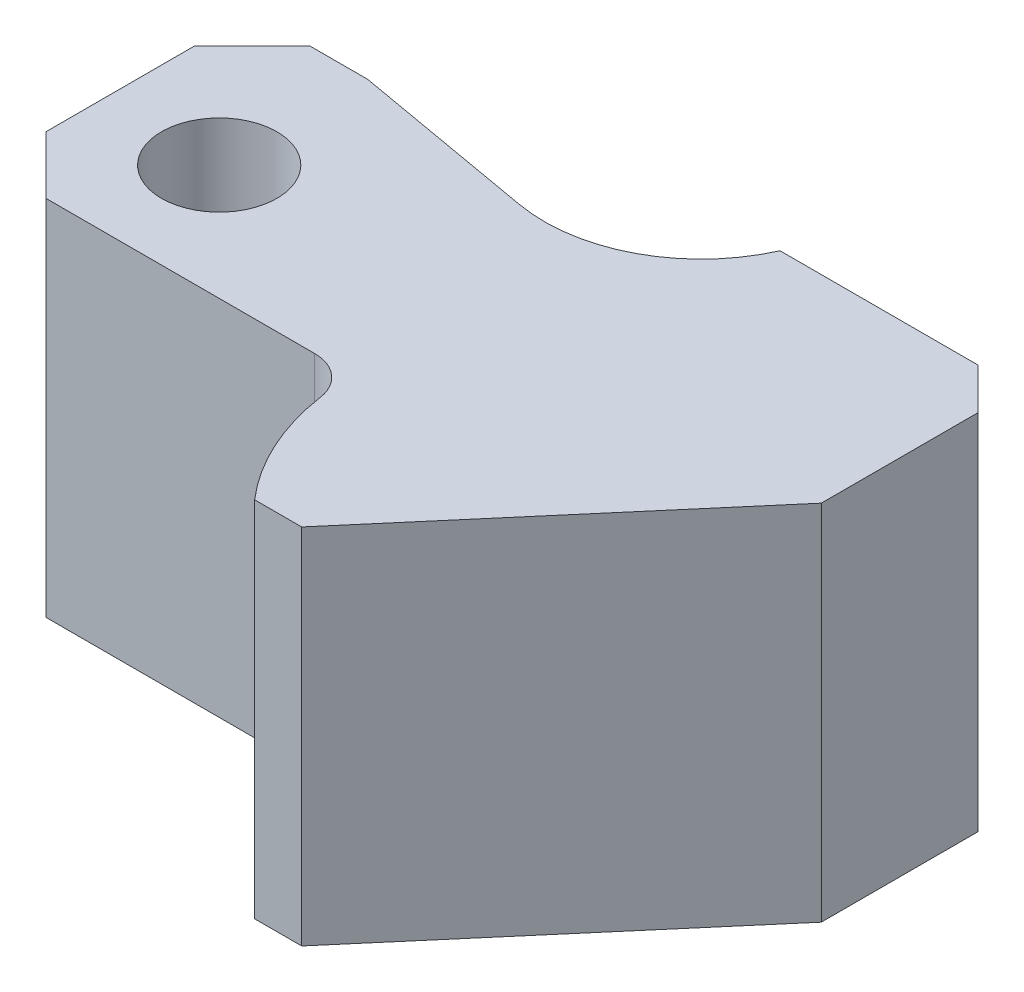
from build123d import *

# Parameters (mm, degrees)
SKETCH2_R           = 7
BOSS_EXTRUDE1_DEPTH = 22


with BuildPart() as part:
    # Sketch2 → Boss-Extrude1 (new, symmetric)
    with BuildSketch(Plane(origin=(0, 0, 0), x_dir=(1, 0, 0), z_dir=(0, 1, 0))):
        with BuildLine():
            Line((-8.044825261, -3.211346175), (-8.044825261, 14.788653825))
            Line((-8.044825261, 14.788653825), (-1.044825261, 21.788653825))
            Line((-1.044825261, 21.788653825), (5.955174739, 21.788653825))
            Line((5.955174739, 21.788653825), (28.316555575, 17.845739058))
            ThreePointArc((28.316555575, 17.845739058), (40.516273445, 19.770697967), (48.955174739, 28.788653825))
            Line((48.955174739, 28.788653825), (72.955174739, 28.788653825))
            Line((72.955174739, 28.788653825), (77.955174739, 23.788653825))
            Line((77.955174739, 23.788653825), (77.955174739, 4.788653825))
            Line((77.955174739, 4.788653825), (48.955174739, -29.211346175))
            Line((48.955174739, -29.211346175), (43.252154792, -29.211346175))
            ThreePointArc((43.252154792, -29.211346175), (38.813182595, -22.327018236), (36.476352392, -14.476052057))
            ThreePointArc((36.476352392, -14.476052057), (34.795949432, -11.424759943), (31.530713651, -10.211346175))
            Line((31.530713651, -10.211346175), (-1.044825261, -10.211346175))
            Line((-1.044825261, -10.211346175), (-8.044825261, -3.211346175))
        make_face()
        with Locations(Location((5.955174739, 3.788653825, 0), (0, 0, 270))):
            Circle(SKETCH2_R, mode=Mode.SUBTRACT)
    extrude(amount=BOSS_EXTRUDE1_DEPTH, both=True)


solid = part.part
